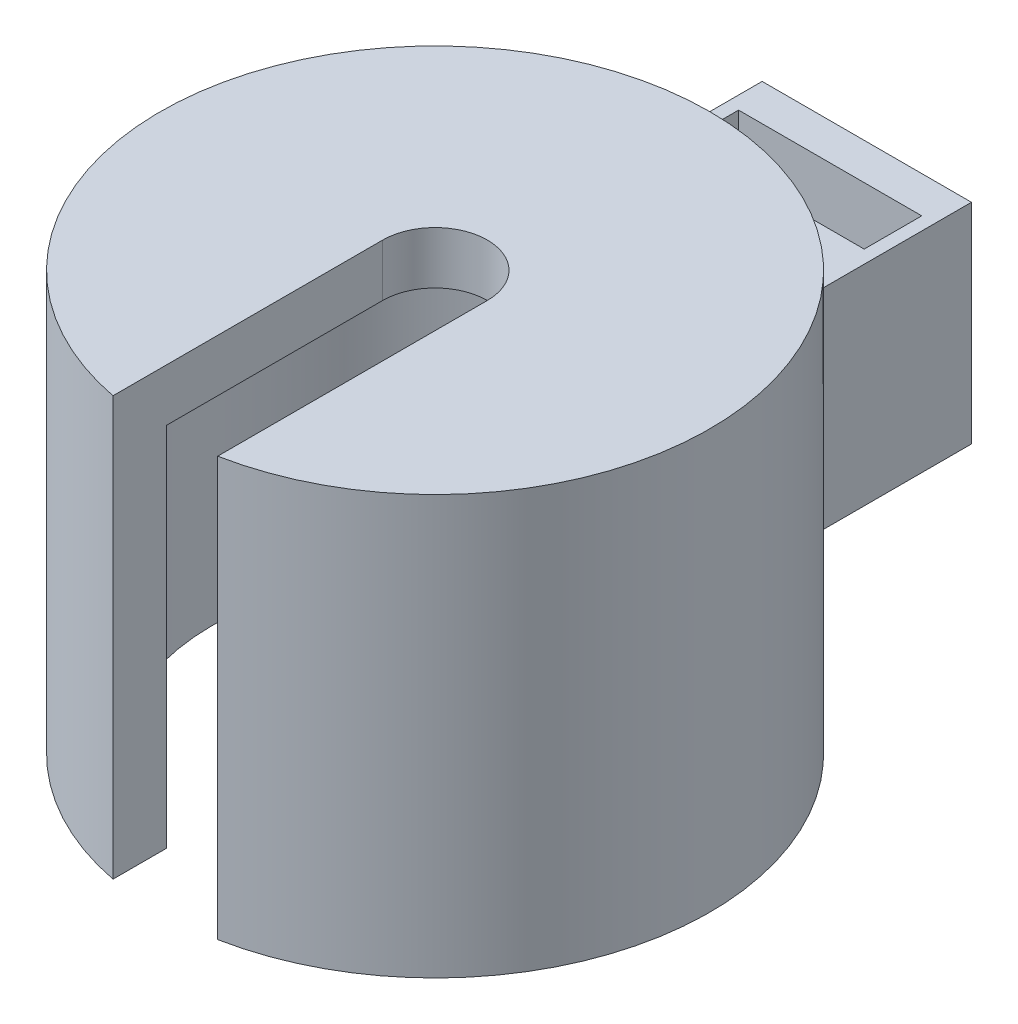
from build123d import *

# Parameters (mm, degrees)
BOSS_EXTRUDE1_DEPTH      = 7
BOSS_EXTRUDE2_DEPTH      = 1
BOSS_EXTRUDE3_DEPTH      = 2
BOSS_EXTRUDE3_DEPTH_BACK = 2
CUT_EXTRUDE1_DEPTH       = 5


with BuildPart() as part:
    # Sketch1 → Boss-Extrude1 (new body)
    with BuildSketch(Plane(origin=(0, 0, 0), x_dir=(1, 0, 0), z_dir=(0, 1, 0))):
        with BuildLine():
            Line((-1, -5.153882032), (-1, -4.13067791))
            ThreePointArc((-1, -4.13067791), (-2.627974505, 3.340097304), (4.25, 0))
            ThreePointArc((4.25, 0), (3.340097304, -2.627974505), (1, -4.13067791))
            Line((1, -4.13067791), (1, -5.153882032))
            ThreePointArc((1, -5.153882032), (4.050462937, -3.340097304), (5.25, 0))
            ThreePointArc((5.25, 0), (-3.340097304, 4.050462937), (-1, -5.153882032))
        make_face()
    extrude(amount=BOSS_EXTRUDE1_DEPTH)

    # Sketch2 → Boss-Extrude2 (add)
    with BuildSketch(Plane(origin=(0, 7, 0), x_dir=(1, 0, 0), z_dir=(0, 1, 0))):
        with BuildLine():
            Line((-1, -4.13067791), (-1, 0))
            ThreePointArc((-1, 0), (0, 1), (1, 0))
            Line((1, 0), (1, -4.13067791))
            ThreePointArc((1, -4.13067791), (0, 4.25), (-1, -4.13067791))
        make_face()
        with BuildLine():
            ThreePointArc((-1, -4.13067791), (0, 4.25), (1, -4.13067791))
            Line((1, -4.13067791), (1, -5.153882032))
            ThreePointArc((1, -5.153882032), (0, 5.25), (-1, -5.153882032))
            Line((-1, -5.153882032), (-1, -4.13067791))
        make_face()
    extrude(amount=BOSS_EXTRUDE2_DEPTH)

    # Sketch3 → Boss-Extrude3 (add, two sides: drawn at the far end of the back side and taken through both)
    with BuildSketch(Plane(origin=(0, 0, 0), x_dir=(0, 0, -1), z_dir=(1, 0, 0)).offset(-BOSS_EXTRUDE3_DEPTH_BACK)):
        Polygon((8.25, 6), (5.25, 6), (4.25, 6), (4.25, 2), (8.25, 2), align=None)
    extrude(amount=BOSS_EXTRUDE3_DEPTH + BOSS_EXTRUDE3_DEPTH_BACK)

    # Sketch4 → Cut-Extrude1 (cut)
    with BuildSketch(Plane(origin=(0, 6, 0), x_dir=(1, 0, 0), z_dir=(0, 1, 0))):
        Polygon((1.75, 7.55), (0, 7.55), (-1.75, 7.55), (-1.75, 6.45), (1.75, 6.45), align=None)
    extrude(amount=-CUT_EXTRUDE1_DEPTH, mode=Mode.SUBTRACT)


solid = part.part
